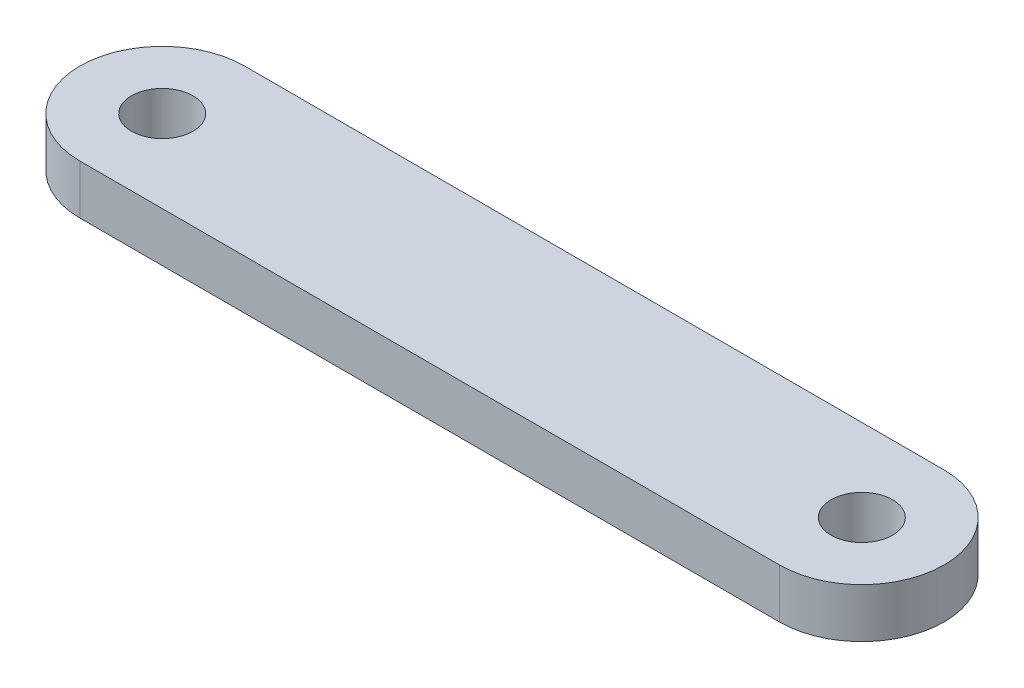
from build123d import *

# Parameters (mm, degrees)
BOSS_EXTRU_1_DEPTH = 3.048
D_GAGEMENT_61_D    = 3.7973


with BuildPart() as part:
    # Esquisse1 → Boss.-Extru.1 (new body)
    with BuildSketch(Plane(origin=(0, 0, 0), x_dir=(1, 0, 0), z_dir=(0, 1, 0))):
        with BuildLine():
            Line((-21.59, 5.08), (21.59, 5.08))
            ThreePointArc((21.59, 5.08), (26.67, 0), (21.59, -5.08))
            Line((21.59, -5.08), (-21.59, -5.08))
            ThreePointArc((-21.59, -5.08), (-26.67, 0), (-21.59, 5.08))
        make_face()
    extrude(amount=BOSS_EXTRU_1_DEPTH)

    # Dégagement #61 (through all)
    with Locations(Plane(origin=(0, 3.048, 0), x_dir=(1, 0, 0), z_dir=(0, 1, 0))):
        with Locations((-21.59, 0), (21.59, 0)):
            Hole(D_GAGEMENT_61_D / 2)


solid = part.part
